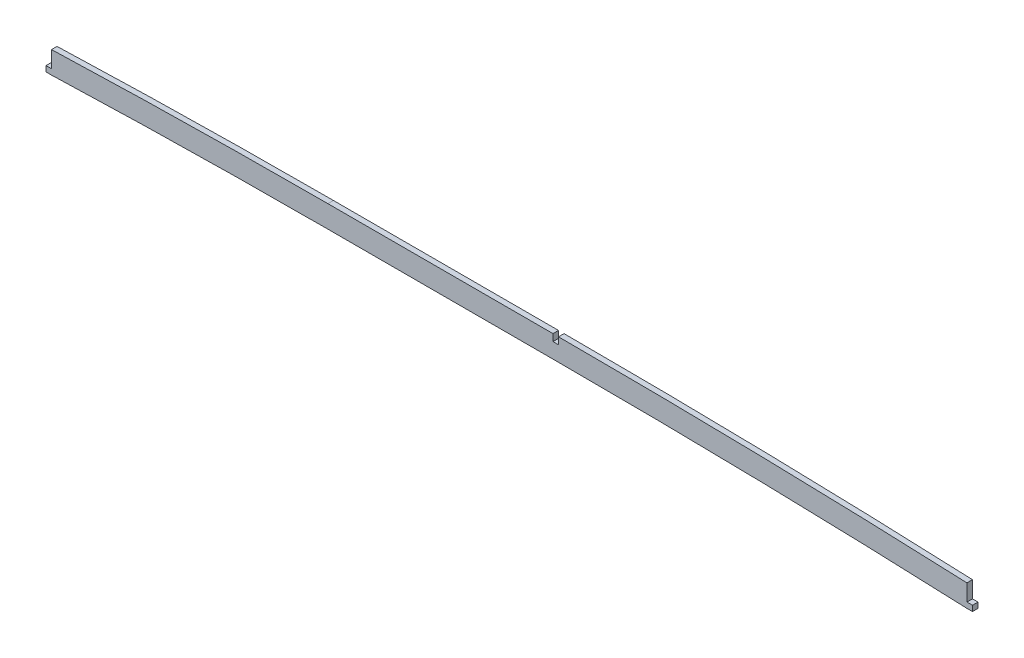
from build123d import *

# Parameters (mm, degrees)
BOSS_EXTRUDE1_DEPTH = 10


with BuildPart() as part:
    # Sketch1 → Boss-Extrude1 (new body)
    with BuildSketch(Plane.XY):
        with BuildLine():
            Line((-70.170888572, 381.474129778), (-477.5, 381.474129778))
            ThreePointArc((-477.5, 381.474129778), (-727.537146474, 379.319055722), (-977.5, 372.854473884))
            Line((-977.5, 372.854473884), (-977.5, 342.830625486))
            Line((-977.5, 342.830625486), (-987.5, 342.830625486))
            Line((-987.5, 342.830625486), (-987.5, 332.830625486))
            Line((-987.5, 332.830625486), (-977.5, 332.830625486))
            ThreePointArc((-977.5, 332.830625486), (-727.537352293, 339.31309229), (-477.5, 341.474129778))
            Line((-477.5, 341.474129778), (-60.170888572, 341.474129778))
            ThreePointArc((-60.170888572, 341.474129778), (237.427772245, 338.863423493), (534.934829654, 331.032108233))
            ThreePointArc((534.934829654, 331.032108233), (606.852618205, 328.354762156), (678.758400695, 325.372324122))
            Line((678.758400695, 325.372324122), (688.758400695, 325.372324122))
            Line((688.758400695, 325.372324122), (688.758400695, 335.372324122))
            Line((688.758400695, 335.372324122), (678.758400695, 335.372324122))
            Line((678.758400695, 335.372324122), (678.758400695, 365.410239494))
            ThreePointArc((678.758400695, 365.410239494), (309.381050642, 377.45768283), (-60.170888572, 381.474129778))
            Line((-60.170888572, 381.474129778), (-60.170888572, 368.974129778))
            Line((-60.170888572, 368.974129778), (-70.170888572, 368.974129778))
            Line((-70.170888572, 368.974129778), (-70.170888572, 381.474129778))
        make_face()
    extrude(amount=BOSS_EXTRUDE1_DEPTH)


solid = part.part
